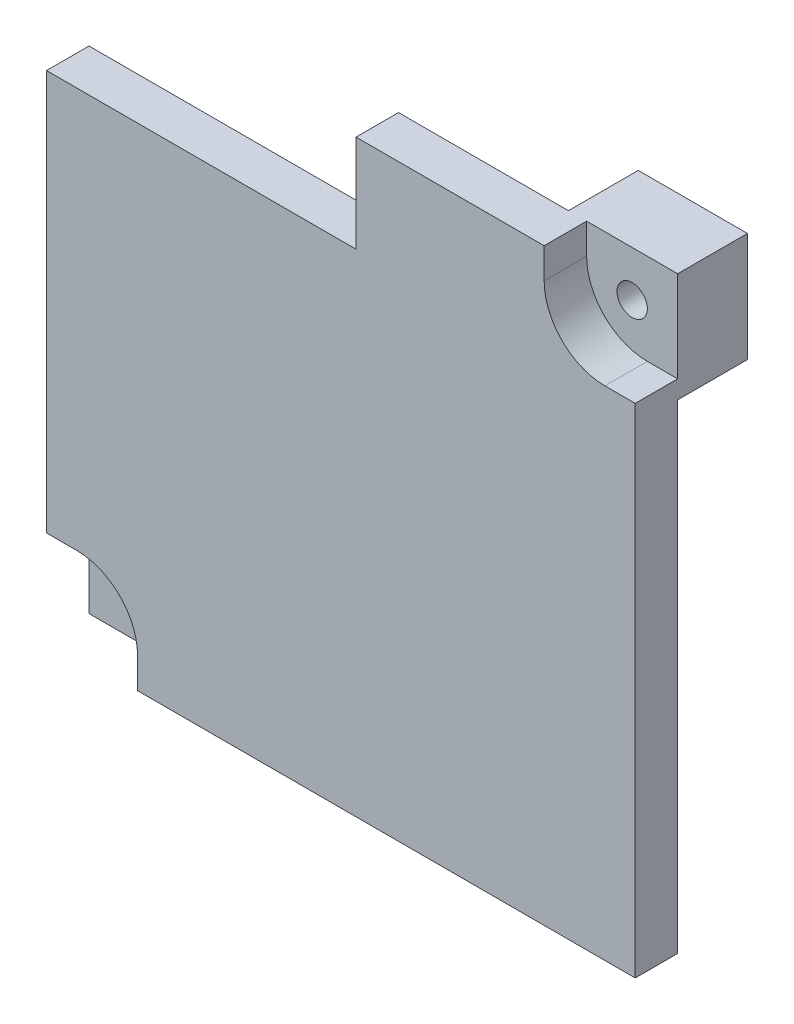
from build123d import *

# Parameters (mm, degrees)
BOSS_EXTRUDE2_DEPTH     = 1.4
SKETCH2_W               = 3.6
SKETCH2_H               = 3.6
SKETCH2_W_2             = 9.5
SKETCH2_H_2             = 9.5
BOSS_EXTRUDE3_DEPTH     = 2.3
CUT_EXTRUDE1_DEPTH      = 14.909349374
CUT_EXTRUDE1_DEPTH_BACK = 14.909349374
SKETCH4_R               = 0.5


with BuildPart() as part:
    # Sketch1 → Boss-Extrude2 (new body)
    with BuildSketch(Plane.XY):
        with BuildLine():
            Line((-6.7, -9.7), (9.7, -9.7))
            Line((9.7, -9.7), (9.7, 6.7))
            Line((9.7, 6.7), (8.7, 6.7))
            ThreePointArc((8.7, 6.7), (7.285786438, 7.285786438), (6.7, 8.7))
            Line((6.7, 8.7), (6.7, 9.7))
            Line((6.7, 9.7), (0.5, 9.7))
            Line((0.5, 9.7), (0.5, 6.5))
            Line((0.5, 6.5), (-9.7, 6.5))
            Line((-9.7, 6.5), (-9.7, -6.7))
            Line((-9.7, -6.7), (-8.7, -6.7))
            ThreePointArc((-8.7, -6.7), (-7.285786438, -7.285786438), (-6.7, -8.7))
            Line((-6.7, -8.7), (-6.7, -9.7))
        make_face()
    extrude(amount=BOSS_EXTRUDE2_DEPTH)

    # Sketch2 → Boss-Extrude3 (add)
    with BuildSketch(Plane(origin=(0, 0, 0), x_dir=(-1, 0, 0), z_dir=(0, 0, -1))):
        with Locations((-7.9, 7.9)):
            Rectangle(SKETCH2_W, SKETCH2_H)
        with Locations((4.95, -4.95)):
            Rectangle(SKETCH2_W_2, SKETCH2_H_2)
    extrude(amount=BOSS_EXTRUDE3_DEPTH)

    # Sketch4 → Cut-Extrude1 (cut, two sides: drawn at the far end of the back side and taken through both)
    with BuildSketch(Plane.XY.offset(-CUT_EXTRUDE1_DEPTH_BACK)):
        with Locations((8.2, 8.2)):
            Circle(SKETCH4_R)
        with Locations((-8.2, -8.2)):
            Circle(SKETCH4_R)
    extrude(amount=CUT_EXTRUDE1_DEPTH + CUT_EXTRUDE1_DEPTH_BACK, mode=Mode.SUBTRACT)


solid = part.part
